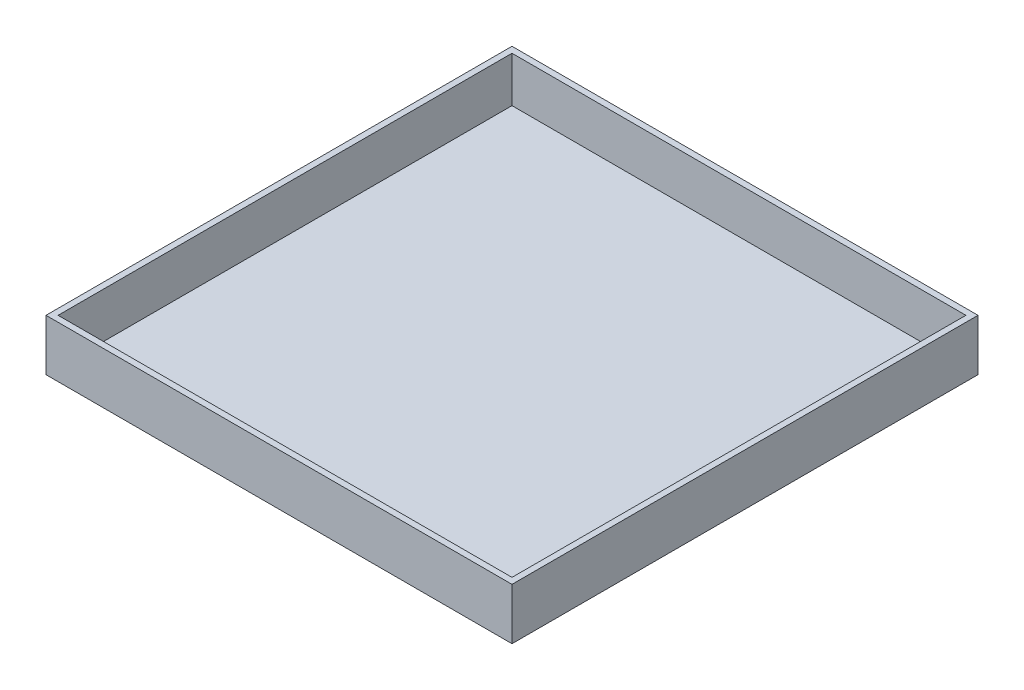
from build123d import *

# Parameters (mm, degrees)
SKETCH1_W           = 150
SKETCH1_H           = 150
BOSS_EXTRUDE1_DEPTH = 2
SKETCH2_W           = 154
SKETCH2_H           = 154
BOSS_EXTRUDE2_DEPTH = 2
SKETCH3_W           = 154
SKETCH3_H           = 154
SKETCH3_W_2         = 150
SKETCH3_H_2         = 150
BOSS_EXTRUDE3_DEPTH = 15


with BuildPart() as part:
    # Sketch1 → Boss-Extrude1 (new body)
    with BuildSketch(Plane(origin=(0, 0, 0), x_dir=(1, 0, 0), z_dir=(0, 1, 0))):
        Rectangle(SKETCH1_W, SKETCH1_H)
    extrude(amount=BOSS_EXTRUDE1_DEPTH)

    # Sketch2 → Boss-Extrude2 (add)
    with BuildSketch(Plane(origin=(0, 2, 0), x_dir=(1, 0, 0), z_dir=(0, 1, 0))):
        Rectangle(SKETCH2_W, SKETCH2_H)
    extrude(amount=-BOSS_EXTRUDE2_DEPTH)

    # Sketch3 → Boss-Extrude3 (add)
    with BuildSketch(Plane(origin=(0, 2, 0), x_dir=(1, 0, 0), z_dir=(0, 1, 0))):
        Rectangle(SKETCH3_W, SKETCH3_H)
        Rectangle(SKETCH3_W_2, SKETCH3_H_2, mode=Mode.SUBTRACT)
    extrude(amount=BOSS_EXTRUDE3_DEPTH)


solid = part.part
